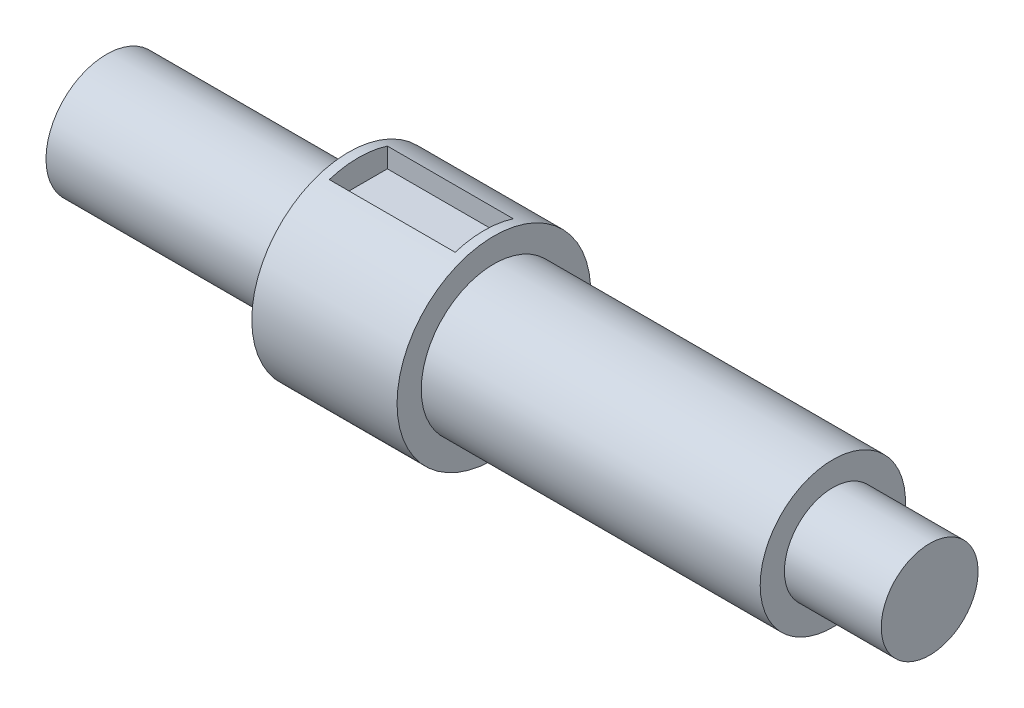
from build123d import *

# Parameters (mm, degrees)
CUT_EXTRUDE_1_DEPTH      = 6
CUT_EXTRUDE_1_DEPTH_BACK = 6
SKETCH_2_W               = 26
SKETCH_2_H               = 10


with BuildPart() as part:
    # 草图1 → 旋转1 (revolve)
    with BuildSketch(Plane.XY):
        Polygon((0, 0), (170, 0), (170, 10), (150, 10), (150, 15), (80, 15), (80, 20), (50, 20), (50, 12.5), (0, 12.5), align=None)
    revolve(axis=Axis((-10, 0, 0), (1, 0, 0)))

    # 草图2 → 切除-拉伸1 (cut, two sides: drawn at the far end of the back side and taken through both)
    with BuildSketch(Plane.XY.offset(-CUT_EXTRUDE_1_DEPTH_BACK)):
        with Locations((65, 20)):
            Rectangle(SKETCH_2_W, SKETCH_2_H)
    extrude(amount=CUT_EXTRUDE_1_DEPTH + CUT_EXTRUDE_1_DEPTH_BACK, mode=Mode.SUBTRACT)


solid = part.part
